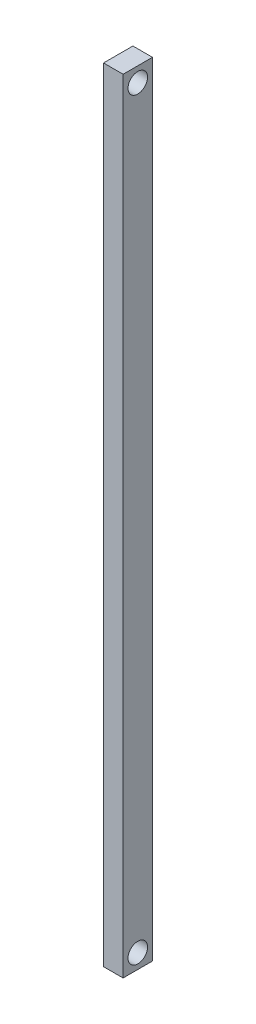
from build123d import *

# Parameters (mm, degrees)
SKETCH1_W           = 400
SKETCH1_H           = 15
BOSS_EXTRUDE1_DEPTH = 10
SKETCH3_R           = 5
CUT_EXTRUDE1_DEPTH  = 10
SKETCH4_R           = 5
CUT_EXTRUDE2_DEPTH  = 10


with BuildPart() as part:
    # Sketch1 → Boss-Extrude1 (new body)
    with BuildSketch(Plane.YZ):
        with Locations((200, 7.5)):
            Rectangle(SKETCH1_W, SKETCH1_H)
    extrude(amount=BOSS_EXTRUDE1_DEPTH)

    # Sketch3 → Cut-Extrude1 (cut)
    with BuildSketch(Plane.YZ):
        with Locations(Location((7.5, 7.5, 0), (0, 0, 270))):
            Circle(SKETCH3_R)
    extrude(amount=CUT_EXTRUDE1_DEPTH, mode=Mode.SUBTRACT)

    # Sketch4 → Cut-Extrude2 (cut)
    with BuildSketch(Plane.YZ.offset(10)):
        with Locations(Location((392.5, 7.5, 0), (0, 0, 270))):
            Circle(SKETCH4_R)
    extrude(amount=-CUT_EXTRUDE2_DEPTH, mode=Mode.SUBTRACT)


solid = part.part
